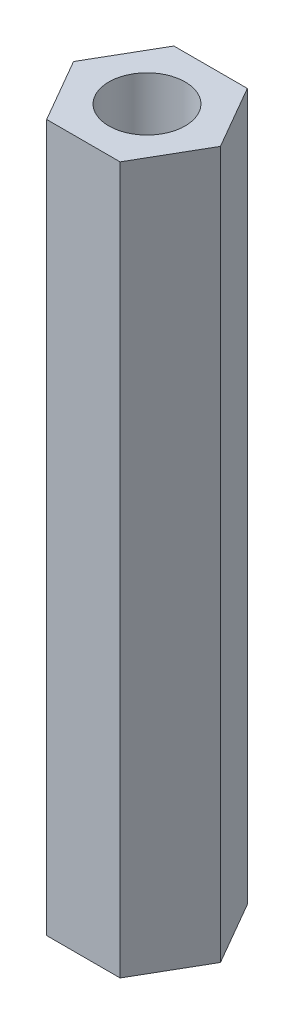
from build123d import *

# Parameters (mm, degrees)
SKETCH1_R           = 1.35
BOSS_EXTRUDE1_DEPTH = 25


with BuildPart() as part:
    # Sketch1 → Boss-Extrude1 (new body)
    with BuildSketch(Plane(origin=(0, 0, 0), x_dir=(1, 0, 0), z_dir=(0, 1, 0))):
        Polygon((-1.299038106, -2.25), (1.299038106, -2.25), (2.598076211, 0), (1.299038106, 2.25), (-1.299038106, 2.25), (-2.598076211, 0), align=None)
        with Locations(Location((0, 0, 0), (0, 0, 270))):
            Circle(SKETCH1_R, mode=Mode.SUBTRACT)
    extrude(amount=BOSS_EXTRUDE1_DEPTH)


solid = part.part
